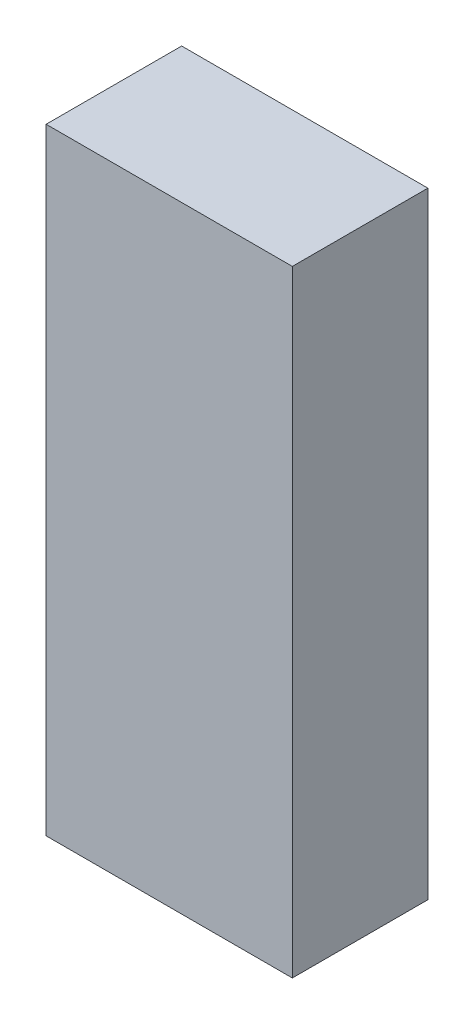
from build123d import *

# Parameters (mm, degrees)
SKETCH1_W           = 27.686
SKETCH1_H           = 69.3
BOSS_EXTRUDE1_DEPTH = 15.24


with BuildPart() as part:
    # Sketch1 → Boss-Extrude1 (new body)
    with BuildSketch(Plane.XY):
        with Locations((13.843, 34.65)):
            Rectangle(SKETCH1_W, SKETCH1_H)
    extrude(amount=BOSS_EXTRUDE1_DEPTH)


solid = part.part
